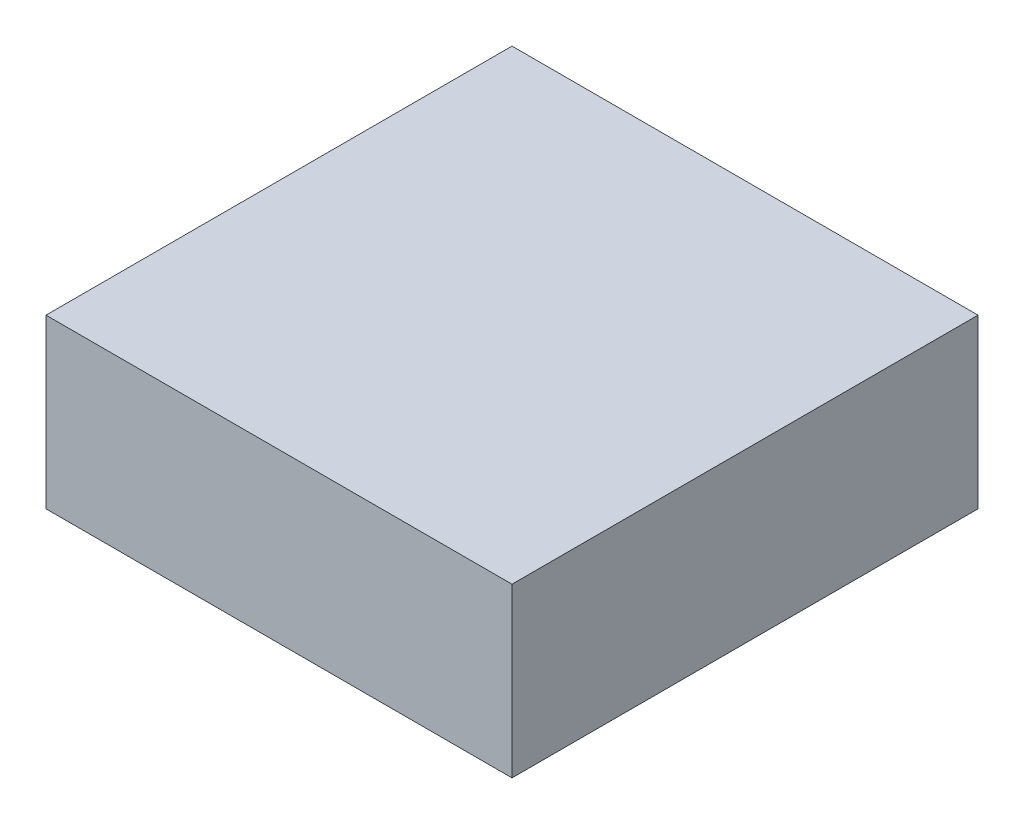
from build123d import *

# Parameters (mm, degrees)
SKETCH_1_W      = 25
SKETCH_1_H      = 25
EXTRUDE_1_DEPTH = 9


with BuildPart() as part:
    # Эскиз1 → Бобышка-Вытянуть1 (new body)
    with BuildSketch(Plane(origin=(0, 0, 0), x_dir=(1, 0, 0), z_dir=(0, 1, 0))):
        Rectangle(SKETCH_1_W, SKETCH_1_H)
    extrude(amount=EXTRUDE_1_DEPTH)


solid = part.part
